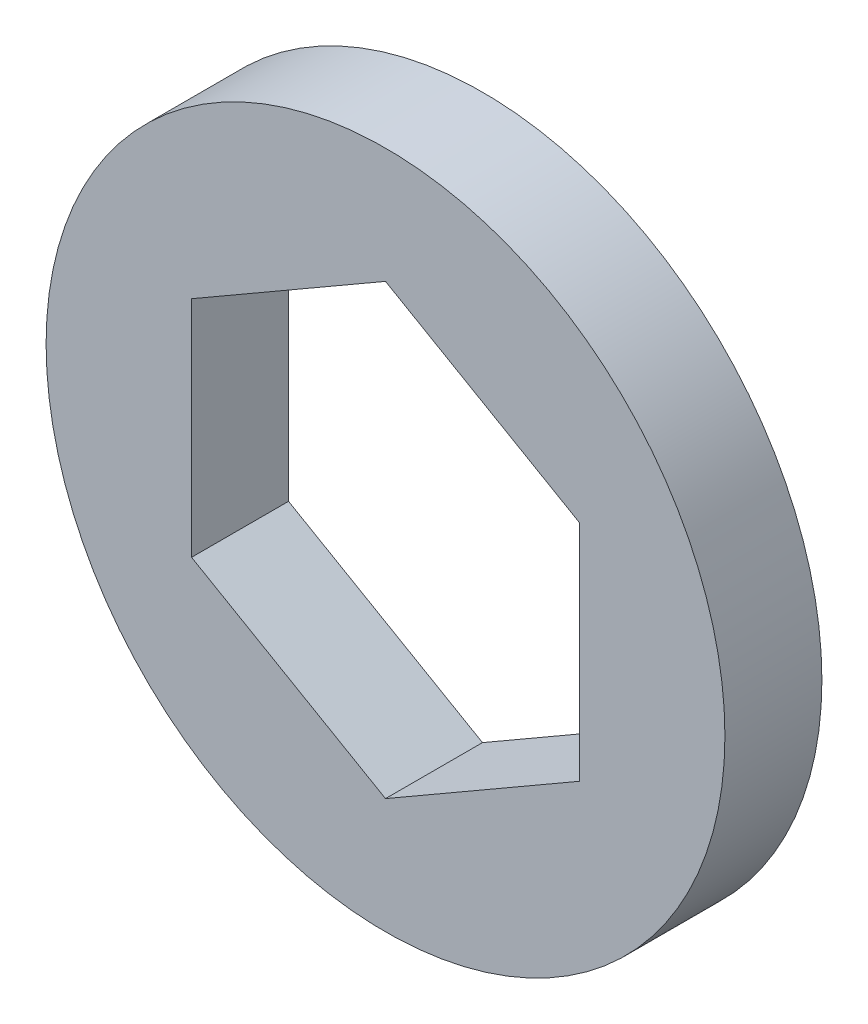
from build123d import *

# Parameters (mm, degrees)
SKETCH1_R           = 11.1125
BOSS_EXTRUDE1_DEPTH = 3.175


with BuildPart() as part:
    # Sketch1 → Boss-Extrude1 (new body)
    with BuildSketch(Plane.XY):
        Circle(SKETCH1_R)
        Polygon((0, 7.332348419), (-6.35, 3.666174209), (-6.35, -3.666174209), (0, -7.332348419), (6.35, -3.666174209), (6.35, 3.666174209), align=None, mode=Mode.SUBTRACT)
    extrude(amount=BOSS_EXTRUDE1_DEPTH)


solid = part.part
